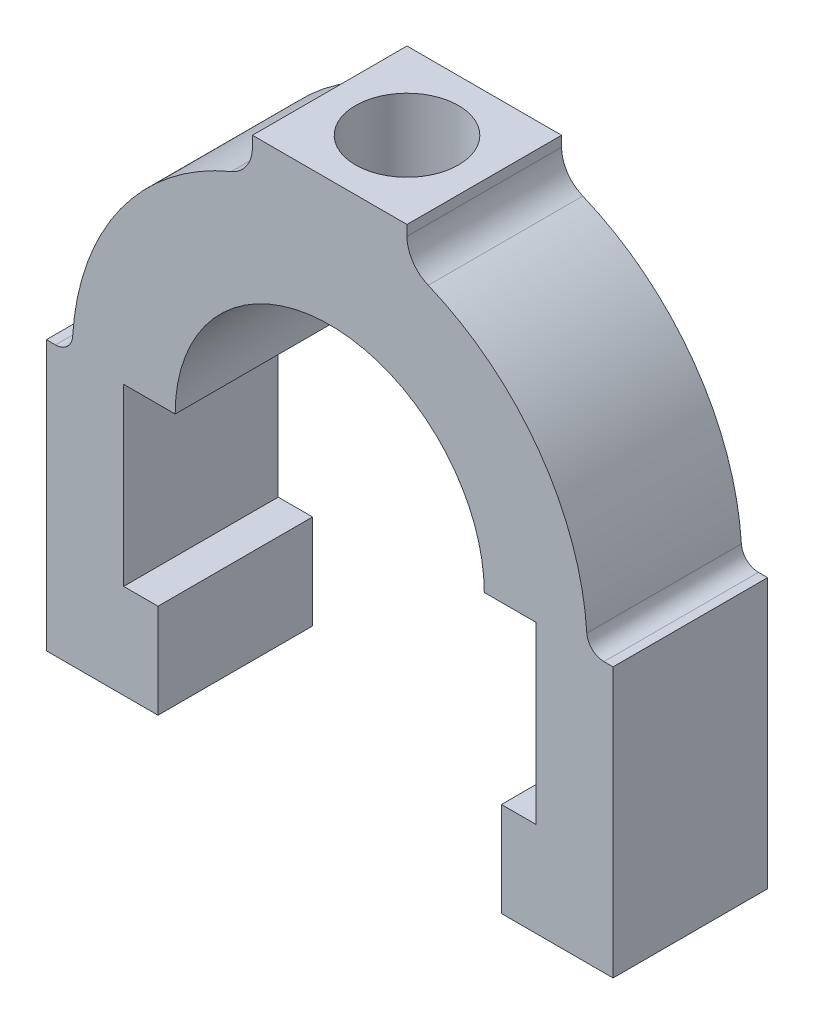
from build123d import *

# Parameters (mm, degrees)
BOSS_EXTRUDE1_DEPTH = 9
FILLET1_R           = 4
FILLET2_R           = 2
HOLE1_D             = 12


with BuildPart() as part:
    # Sketch1 → Boss-Extrude1 (new, symmetric)
    with BuildSketch(Plane.XY):
        with BuildLine():
            Line((-30, 0), (-33, 0))
            Line((-33, 0), (-33, -31.381823957))
            Line((-33, -31.381823957), (-20, -31.381823957))
            Line((-20, -31.381823957), (-20, -20.381823957))
            Line((-20, -20.381823957), (-24, -20.381823957))
            Line((-24, -20.381823957), (-24, 0))
            Line((-24, 0), (-18, 0))
            ThreePointArc((-18, 0), (0, 18), (18, 0))
            Line((18, 0), (24, 0))
            Line((24, 0), (24, -20.381823957))
            Line((24, -20.381823957), (20, -20.381823957))
            Line((20, -20.381823957), (20, -31.381823957))
            Line((20, -31.381823957), (33, -31.381823957))
            Line((33, -31.381823957), (33, 0))
            Line((33, 0), (30, 0))
            ThreePointArc((30, 0), (24.186773245, 17.748239349), (9, 28.618176043))
            Line((9, 28.618176043), (9, 32.618176043))
            Line((9, 32.618176043), (-9, 32.618176043))
            Line((-9, 32.618176043), (-9, 28.618176043))
            ThreePointArc((-9, 28.618176043), (-24.186773245, 17.748239349), (-30, 0))
        make_face()
    extrude(amount=BOSS_EXTRUDE1_DEPTH, both=True)

    # Fillet1
    fillet1_edges = [part.edges().sort_by_distance(p)[0] for p in [
        (-9, 28.618176043, 0),
        (9, 28.618176043, 0),
    ]]
    fillet(fillet1_edges, radius=FILLET1_R)

    # Fillet2
    fillet2_edges = [part.edges().sort_by_distance(p)[0] for p in [
        (30, 0, 0),
        (-30, 0, 0),
    ]]
    fillet(fillet2_edges, radius=FILLET2_R)

    # Hole1 (through all)
    with Locations(Plane(origin=(0, 32.618176043, 0), x_dir=(1, 0, 0), z_dir=(0, 1, 0))):
        with Locations((0, 0)):
            Hole(HOLE1_D / 2)


solid = part.part
